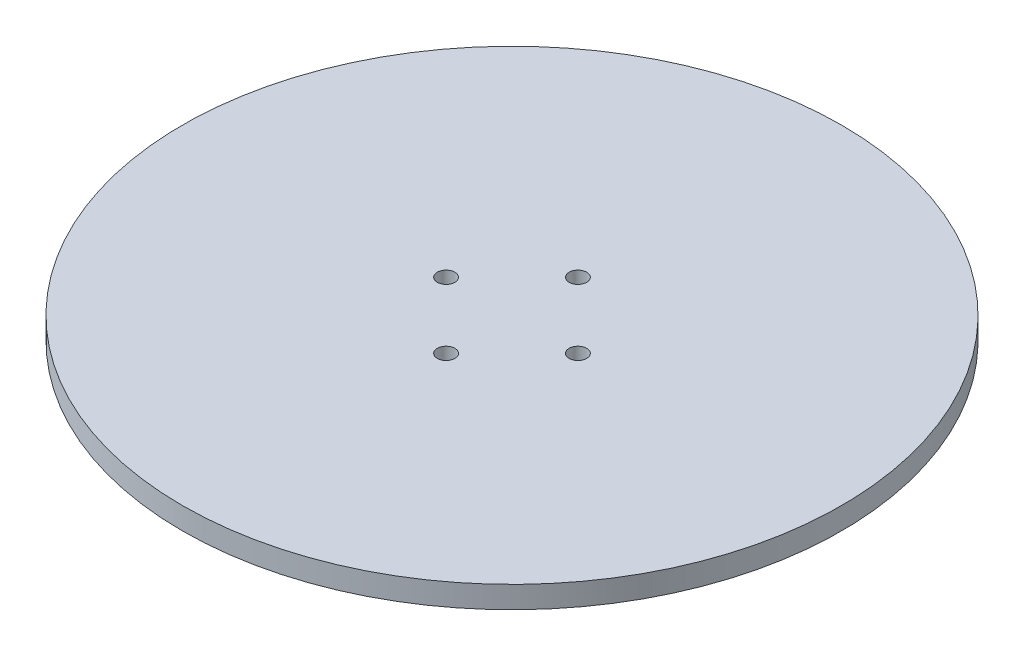
from build123d import *

# Parameters (mm, degrees)
SKETCH1_R           = 75
BOSS_EXTRUDE1_DEPTH = 5
CUT_EXTRUDE1_REACH  = 108.184
SKETCH2_R           = 2
CIRPATTERN1_COUNT   = 4


with BuildPart() as part:
    # Sketch1 → Boss-Extrude1 (new body)
    with BuildSketch(Plane(origin=(0, 0, 0), x_dir=(1, 0, 0), z_dir=(0, 1, 0))):
        with Locations(Location((0, 0, 0), (0, 0, 270))):
            Circle(SKETCH1_R)
    extrude(amount=BOSS_EXTRUDE1_DEPTH)

    # Sketch2 → Cut-Extrude1 (cut, up to next)
    with BuildSketch(Plane(origin=(0, 5, 0), x_dir=(1, 0, 0), z_dir=(0, 1, 0)), mode=Mode.PRIVATE) as cut_extrude1_sk1:
        with Locations(Location((0, 15, 0), (0, 0, 270))):
            Circle(SKETCH2_R)
    cut_extrude1_tool1 = extrude(cut_extrude1_sk1.sketch, amount=-CUT_EXTRUDE1_REACH, mode=Mode.PRIVATE) & part.part
    cut_extrude1 = cut_extrude1_tool1.solids().sort_by_distance((0, 5, -15))[0]
    add(cut_extrude1, mode=Mode.SUBTRACT)

    # CirPattern1: Cut-Extrude1 ×4 about axis
    cirpattern1_axis = Axis((0, 0, 0), (0, 1, 0))
    for i in range(1, CIRPATTERN1_COUNT):
        add(cut_extrude1.rotate(cirpattern1_axis, i * 360 / CIRPATTERN1_COUNT), mode=Mode.SUBTRACT)


solid = part.part
